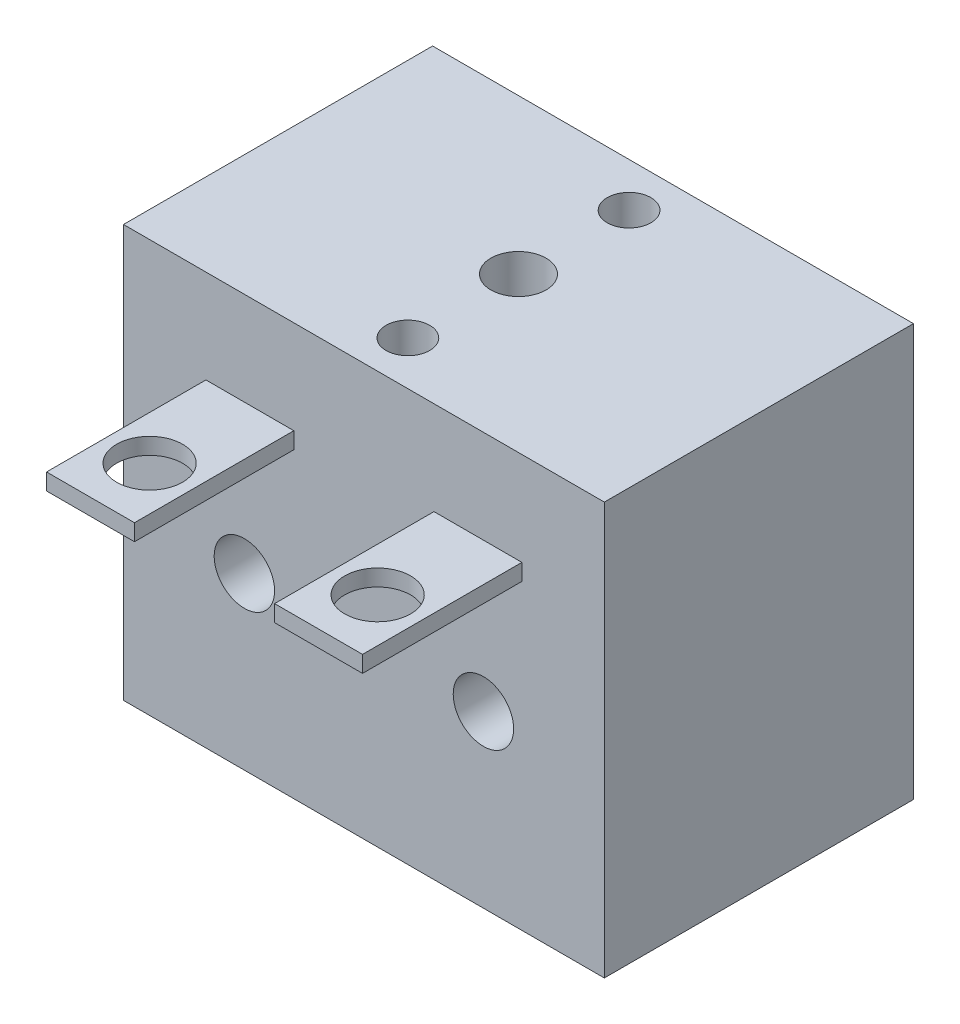
from build123d import *

# Parameters (mm, degrees)
SKETCH1_W          = 44.45
SKETCH1_H          = 28.575
EXTRUDE1_DEPTH     = 38.1
SKETCH2_R          = 2.5527
SKETCH2_R_2        = 2.0193
CUT_EXTRUDE1_DEPTH = 66.145553379
SKETCH3_R          = 2.794
CUT_EXTRUDE2_DEPTH = 66.145553379
SKETCH4_W          = 8.128
SKETCH4_H          = 1.524
EXTRUDE2_DEPTH     = 14.732
SKETCH5_R          = 3.048
CUT_EXTRUDE3_DEPTH = 61.501738992


with BuildPart() as part:
    # Sketch1 → Extrude1 (new body)
    with BuildSketch(Plane(origin=(0, 0, 0), x_dir=(1, 0, 0), z_dir=(0, 1, 0))):
        with Locations((22.225, 14.2875)):
            Rectangle(SKETCH1_W, SKETCH1_H)
    extrude(amount=EXTRUDE1_DEPTH)

    # Sketch2 → Cut-Extrude1 (cut, through all)
    with BuildSketch(Plane(origin=(0, 38.1, 0), x_dir=(-1, 0, 0), z_dir=(0, 1, 0))):
        with Locations(Location((-22.225, -14.2875, 0), (0, 0, 90))):
            Circle(SKETCH2_R)
        with Locations(Location((-22.225, -24.511, 0), (0, 0, 90))):
            Circle(SKETCH2_R_2)
        with Locations(Location((-22.225, -4.064, 0), (0, 0, 90))):
            Circle(SKETCH2_R_2)
    extrude(amount=-CUT_EXTRUDE1_DEPTH, mode=Mode.SUBTRACT)

    # Sketch3 → Cut-Extrude2 (cut, through all)
    with BuildSketch(Plane(origin=(0, 0, -28.575), x_dir=(-1, 0, 0), z_dir=(0, 0, -1))):
        with Locations((-33.274, 15.748)):
            Circle(SKETCH3_R)
        with Locations((-11.176, 15.748)):
            Circle(SKETCH3_R)
    extrude(amount=-CUT_EXTRUDE2_DEPTH, mode=Mode.SUBTRACT)

    # Sketch4 → Extrude2 (add)
    with BuildSketch(Plane.XY):
        with Locations((11.684, 28.702)):
            Rectangle(SKETCH4_W, SKETCH4_H)
        with Locations((32.766, 28.702)):
            Rectangle(SKETCH4_W, SKETCH4_H)
    extrude(amount=EXTRUDE2_DEPTH)

    # Sketch5 → Cut-Extrude3 (cut, through all)
    with BuildSketch(Plane(origin=(0, 29.464, 0), x_dir=(-1, 0, 0), z_dir=(0, 1, 0))):
        with Locations(Location((-11.684, 9.271, 0), (0, 0, 90))):
            Circle(SKETCH5_R)
        with Locations(Location((-32.766, 9.271, 0), (0, 0, 90))):
            Circle(SKETCH5_R)
    extrude(amount=-CUT_EXTRUDE3_DEPTH, mode=Mode.SUBTRACT)


solid = part.part
